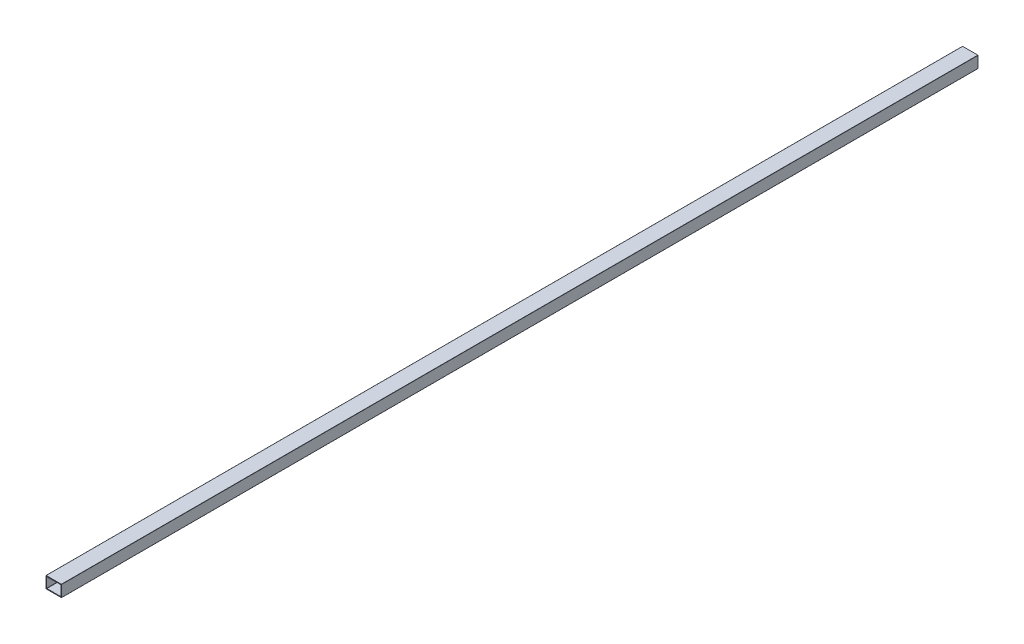
from build123d import *

# Parameters (mm, degrees)
CROQUIS1_W              = 101.6
CROQUIS1_H              = 76.2
CROQUIS1_W_2            = 92.5
CROQUIS1_H_2            = 67.1
SALIENTE_EXTRUIR1_DEPTH = 6000
REDONDEO1_R             = 1


with BuildPart() as part:
    # Croquis1 → Saliente-Extruir1 (new body)
    with BuildSketch(Plane.XY):
        Rectangle(CROQUIS1_W, CROQUIS1_H)
        Rectangle(CROQUIS1_W_2, CROQUIS1_H_2, mode=Mode.SUBTRACT)
    extrude(amount=-SALIENTE_EXTRUIR1_DEPTH)

    # Redondeo1
    redondeo1_edges = [part.edges().sort_by_distance(p)[0] for p in [
        (46.25, -33.55, -3000),
        (-46.25, -33.55, -3000),
        (-46.25, 33.55, -3000),
        (46.25, 33.55, -3000),
        (50.8, -38.1, -3000),
        (-50.8, -38.1, -3000),
        (-50.8, 38.1, -3000),
        (50.8, 38.1, -3000),
    ]]
    fillet(redondeo1_edges, radius=REDONDEO1_R)


solid = part.part
